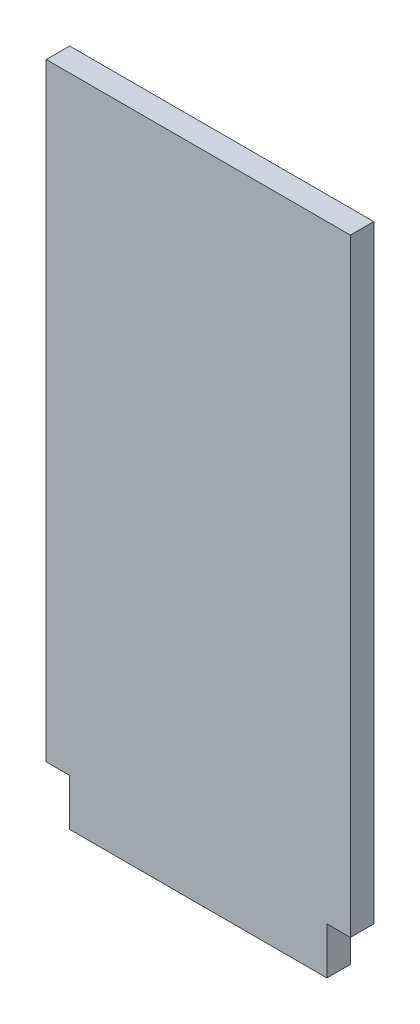
from build123d import *

# Parameters (mm, degrees)
EXTRUDE_1_DEPTH = 5


with BuildPart() as part:
    # 草图1 → 凸台-拉伸1 (new body)
    with BuildSketch(Plane.XY):
        Polygon((27.5, -70), (-27.5, -70), (-27.5, -60), (-32.5, -60), (-32.5, 70), (32.5, 70), (32.5, -60), (27.5, -60), align=None)
    extrude(amount=EXTRUDE_1_DEPTH)


solid = part.part
